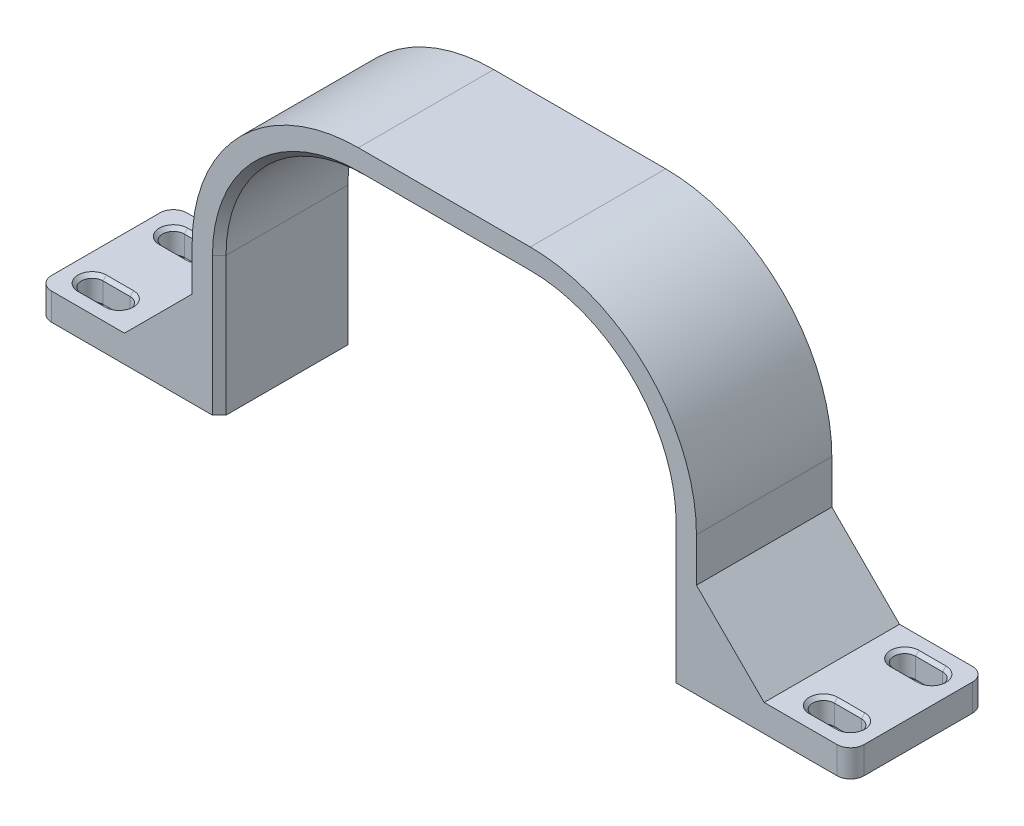
from build123d import *

# Parameters (mm, degrees)
BOSS_EXTRUDE1_DEPTH = 20
FILLET1_R           = 2
CUT_EXTRUDE1_DEPTH  = 76.381086892
CHAMFER1_SIZE       = 0.5
CHAMFER2_SIZE       = 10
CHAMFER3_SIZE       = 1


with BuildPart() as part:
    # Sketch1 → Boss-Extrude1 (new body)
    with BuildSketch(Plane.XY):
        with BuildLine():
            Line((12.7, 20.547), (-12.7, 20.547))
            ThreePointArc((-12.7, 20.547), (-27.228923033, 14.528923033), (-33.247, 0))
            Line((-33.247, 0), (-33.247, -20.447))
            Line((-33.247, -20.447), (-60.015, -20.447))
            Line((-60.015, -20.447), (-60.015, -16.447))
            Line((-60.015, -16.447), (-37.247, -16.447))
            Line((-37.247, -16.447), (-37.247, 0))
            ThreePointArc((-37.247, 0), (-30.057350158, 17.357350158), (-12.7, 24.547))
            Line((-12.7, 24.547), (12.7, 24.547))
            ThreePointArc((12.7, 24.547), (30.057350158, 17.357350158), (37.247, 0))
            Line((37.247, 0), (37.247, -16.447))
            Line((37.247, -16.447), (60.015, -16.447))
            Line((60.015, -16.447), (60.015, -20.447))
            Line((60.015, -20.447), (33.247, -20.447))
            Line((33.247, -20.447), (33.247, 0))
            ThreePointArc((33.247, 0), (27.228923033, 14.528923033), (12.7, 20.547))
        make_face()
    extrude(amount=BOSS_EXTRUDE1_DEPTH)

    # Fillet1
    fillet1_edges = [part.edges().sort_by_distance(p)[0] for p in [
        (60.015, -18.447, 20),
        (-60.015, -18.447, 0),
        (60.015, -18.447, 0),
        (-60.015, -18.447, 20),
    ]]
    fillet(fillet1_edges, radius=FILLET1_R)

    # Sketch3 → Cut-Extrude1 (cut, through all)
    with BuildSketch(Plane(origin=(0, -16.447, 0), x_dir=(1, 0, 0), z_dir=(0, 1, 0))):
        with BuildLine():
            Line((52.015, -2.4), (56.015, -2.4))
            ThreePointArc((56.015, -2.4), (57.615, -4), (56.015, -5.6))
            Line((56.015, -5.6), (52.015, -5.6))
            ThreePointArc((52.015, -5.6), (50.415, -4), (52.015, -2.4))
        make_face()
        with BuildLine():
            Line((56.015, -17.6), (52.015, -17.6))
            ThreePointArc((52.015, -17.6), (50.415, -16), (52.015, -14.4))
            Line((52.015, -14.4), (56.015, -14.4))
            ThreePointArc((56.015, -14.4), (57.615, -16), (56.015, -17.6))
        make_face()
        with BuildLine():
            Line((-52.015, -5.6), (-56.015, -5.6))
            ThreePointArc((-56.015, -5.6), (-57.615, -4), (-56.015, -2.4))
            Line((-56.015, -2.4), (-52.015, -2.4))
            ThreePointArc((-52.015, -2.4), (-50.415, -4), (-52.015, -5.6))
        make_face()
        with BuildLine():
            Line((-56.015, -14.4), (-52.015, -14.4))
            ThreePointArc((-52.015, -14.4), (-50.415, -16), (-52.015, -17.6))
            Line((-52.015, -17.6), (-56.015, -17.6))
            ThreePointArc((-56.015, -17.6), (-57.615, -16), (-56.015, -14.4))
        make_face()
    extrude(amount=-CUT_EXTRUDE1_DEPTH, mode=Mode.SUBTRACT)

    # Chamfer1
    chamfer1_edges = [part.edges().sort_by_distance(p)[0] for p in [
        (-50.415, -20.447, 16),
        (-54.015, -20.447, 17.6),
        (-57.615, -20.447, 16),
        (-54.015, -20.447, 14.4),
        (-50.415, -16.447, 16),
        (-54.015, -16.447, 14.4),
        (-57.615, -16.447, 16),
        (-54.015, -16.447, 17.6),
        (50.415, -20.447, 4),
        (54.015, -20.447, 2.4),
        (57.615, -20.447, 4),
        (54.015, -20.447, 5.6),
        (50.415, -16.447, 4),
        (54.015, -16.447, 5.6),
        (57.615, -16.447, 4),
        (54.015, -16.447, 2.4),
        (57.615, -20.447, 16),
        (54.015, -20.447, 17.6),
        (50.415, -20.447, 16),
        (54.015, -20.447, 14.4),
        (57.615, -16.447, 16),
        (54.015, -16.447, 14.4),
        (50.415, -16.447, 16),
        (54.015, -16.447, 17.6),
        (-50.415, -20.447, 4),
        (-54.015, -20.447, 5.6),
        (-57.615, -20.447, 4),
        (-54.015, -20.447, 2.4),
        (-50.415, -16.447, 4),
        (-54.015, -16.447, 2.4),
        (-57.615, -16.447, 4),
        (-54.015, -16.447, 5.6),
    ]]
    chamfer(chamfer1_edges, length=CHAMFER1_SIZE)

    # Chamfer2
    chamfer2_edges = [part.edges().sort_by_distance(p)[0] for p in [
        (-37.247, -16.447, 10),
        (37.247, -16.447, 10),
    ]]
    chamfer(chamfer2_edges, length=CHAMFER2_SIZE)

    # Chamfer3
    chamfer3_edges = [part.edges().sort_by_distance(p)[0] for p in [
        (0, 20.547, 0),
        (-27.228923033, 14.528923033, 0),
        (-33.247, -10.2235, 0),
        (33.247, -10.2235, 0),
        (27.228923033, 14.528923033, 0),
        (27.228923033, 14.528923033, 20),
        (-33.247, -10.2235, 20),
        (-27.228923033, 14.528923033, 20),
        (0, 20.547, 20),
        (33.247, -10.2235, 20),
    ]]
    chamfer(chamfer3_edges, length=CHAMFER3_SIZE)


solid = part.part
